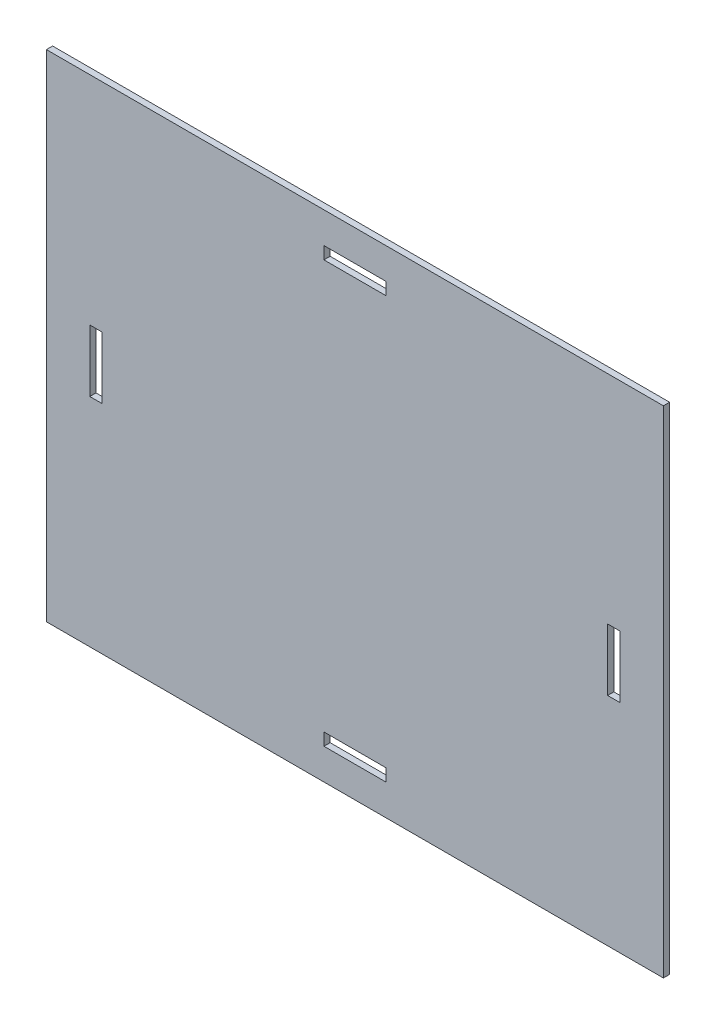
from build123d import *

# Parameters (mm, degrees)
SKETCH_1_W          = 99.6
SKETCH_1_H          = 80
EXTRUDE_1_DEPTH     = 1
SKETCH_2_W          = 10
SKETCH_2_H          = 2
SKETCH_2_W_2        = 2
SKETCH_2_H_2        = 10
CUT_EXTRUDE_1_DEPTH = 10


with BuildPart() as part:
    # 草图1 → 凸台-拉伸1 (new body)
    with BuildSketch(Plane.XY):
        with Locations((-42.642975207, 35.776859504)):
            Rectangle(SKETCH_1_W, SKETCH_1_H)
    extrude(amount=EXTRUDE_1_DEPTH)

    # 草图2 → 切除-拉伸1 (cut)
    with BuildSketch(Plane.XY.offset(1)):
        with Locations((-42.642975207, 69.776859504)):
            Rectangle(SKETCH_2_W, SKETCH_2_H)
        with Locations((-42.642975207, 1.776859504)):
            Rectangle(SKETCH_2_W, SKETCH_2_H)
        with Locations((-84.442975207, 35.776859504)):
            Rectangle(SKETCH_2_W_2, SKETCH_2_H_2)
        with Locations((-0.842975207, 35.776859504)):
            Rectangle(SKETCH_2_W_2, SKETCH_2_H_2)
    extrude(amount=-CUT_EXTRUDE_1_DEPTH, mode=Mode.SUBTRACT)


solid = part.part
